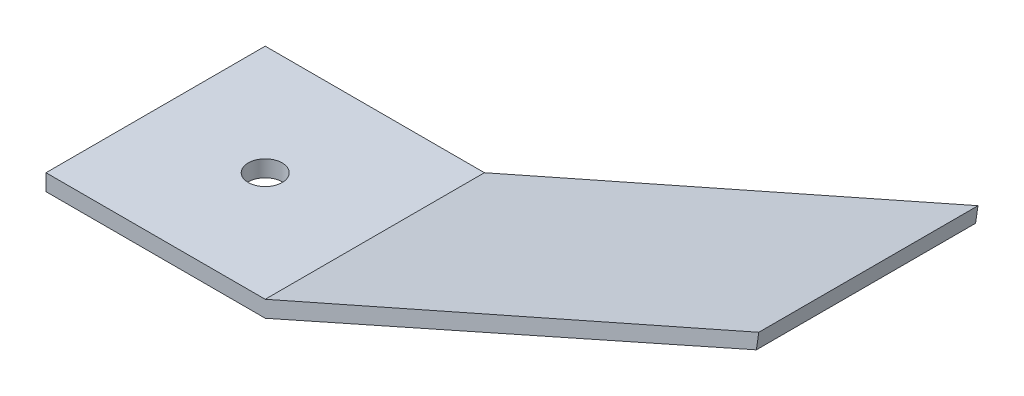
from build123d import *

# Parameters (mm, degrees)
SKETCH1_W           = 40
SKETCH1_H           = 40
SKETCH1_R           = 3.1
BOSS_EXTRUDE1_DEPTH = 3
BOSS_EXTRUDE2_DEPTH = 40


with BuildPart() as part:
    # Sketch1 → Boss-Extrude1 (new body)
    with BuildSketch(Plane(origin=(0, 0, 0), x_dir=(1, 0, 0), z_dir=(0, 1, 0))):
        Rectangle(SKETCH1_W, SKETCH1_H)
        with Locations(Location((0, 0, 0), (0, 0, 270))):
            Circle(SKETCH1_R, mode=Mode.SUBTRACT)
    extrude(amount=BOSS_EXTRUDE1_DEPTH)

    # Sketch6 → Boss-Extrude2 (add)
    with BuildSketch(Plane(origin=(0, 0, -20), x_dir=(-1, 0, 0), z_dir=(0, 0, -1))):
        Polygon((-109.619318504, 39.815596494), (-20, 0), (-20, 3), (-110.058959884, 42.815596494), align=None)
    extrude(amount=-BOSS_EXTRUDE2_DEPTH)


solid = part.part
